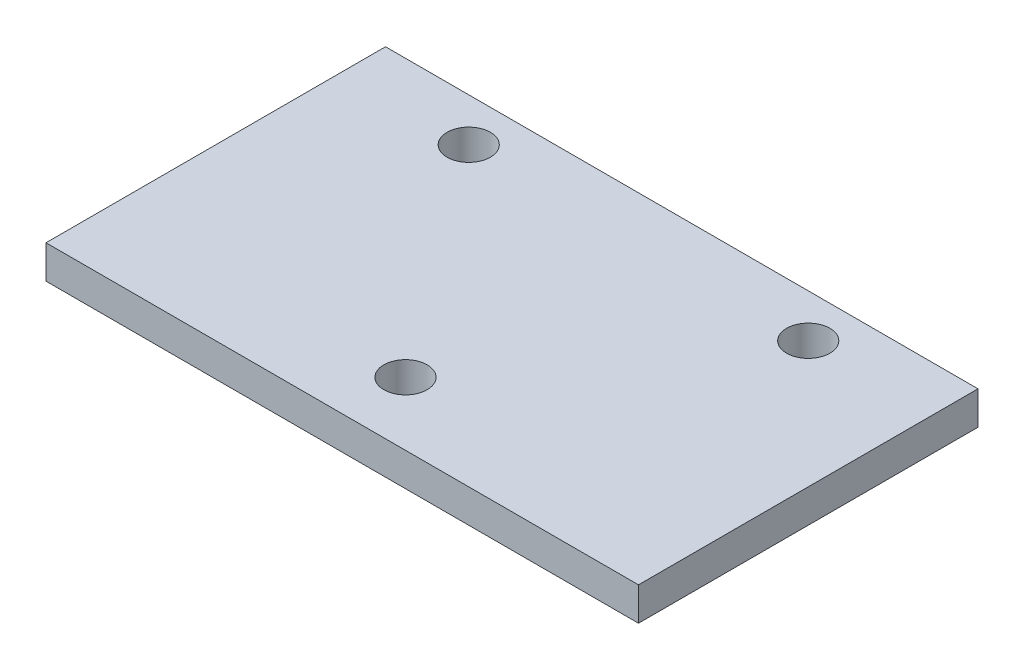
from build123d import *

# Parameters (mm, degrees)
SKETCH1_W   = 178
SKETCH1_H   = 102
PLATE_DEPTH = 10
SKETCH2_R   = 6.5
HOLES_DEPTH = 104.063087476


with BuildPart() as part:
    # Sketch1 → Plate (new body)
    with BuildSketch(Plane(origin=(0, 0, 0), x_dir=(1, 0, 0), z_dir=(0, 1, 0))):
        Rectangle(SKETCH1_W, SKETCH1_H)
    extrude(amount=PLATE_DEPTH)

    # Sketch2 → Holes (cut, through all)
    with BuildSketch(Plane(origin=(0, 10, 0), x_dir=(-1, 0, 0), z_dir=(0, 1, 0))):
        with Locations(Location((51, -38, 0), (0, 0, 90))):
            Circle(SKETCH2_R)
        with Locations(Location((-51, -38, 0), (0, 0, 90))):
            Circle(SKETCH2_R)
        with Locations(Location((0, 32, 0), (0, 0, 90))):
            Circle(SKETCH2_R)
    extrude(amount=-HOLES_DEPTH, mode=Mode.SUBTRACT)


solid = part.part
